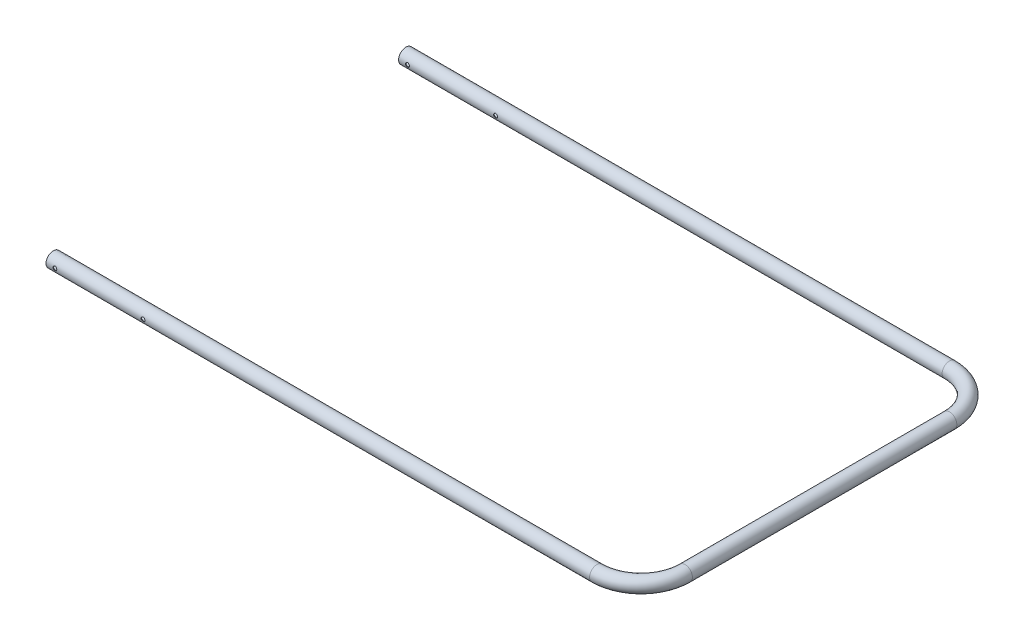
from build123d import *

# Parameters (mm, degrees)
SKETCH2_R               = 12.7
SKETCH2_R_2             = 11.7
CUT_EXTRUDE1_DEPTH      = 1065.529727188
CUT_EXTRUDE1_DEPTH_BACK = 1065.529727188
SKETCH3_R               = 3.3782
CUT_EXTRUDE2_DEPTH      = 1065.529727283
CUT_EXTRUDE2_DEPTH_BACK = 1065.529727283
SKETCH4_R               = 3.3782


with BuildPart() as part:
    # Sweep-Thin1: sweep along a path in Sketch1
    with BuildLine(Plane(origin=(0, 0, 0), x_dir=(1, 0, 0), z_dir=(0, 1, 0))) as sweep_thin1_path:
        Line((-1016, 304.8), (-76.2, 304.8))
        ThreePointArc((-76.2, 304.8), (-22.318463274, 282.481536726), (0, 228.6))
        Line((0, 228.6), (0, -228.6))
        ThreePointArc((0, -228.6), (-22.318463274, -282.481536726), (-76.2, -304.8))
        Line((-76.2, -304.8), (-1016, -304.8))
    # Sketch2 → Sweep-Thin1 (sweep)
    with BuildSketch(Plane(origin=(-1016, 0, 0), x_dir=(0, 0, -1), z_dir=(1, 0, 0))):
        with Locations((304.8, 0)):
            Circle(SKETCH2_R)
        with Locations((304.8, 0)):
            Circle(SKETCH2_R_2, mode=Mode.SUBTRACT)
    sweep(path=sweep_thin1_path.line)

    # Sketch3 → Cut-Extrude1 (cut, two sides: drawn at the far end of the back side and taken through both)
    with BuildSketch(Plane.XY.offset(-CUT_EXTRUDE1_DEPTH_BACK)):
        with Locations((-1000.76, 0)):
            Circle(SKETCH3_R)
    extrude(amount=CUT_EXTRUDE1_DEPTH + CUT_EXTRUDE1_DEPTH_BACK, mode=Mode.SUBTRACT)

    # Sketch4 → Cut-Extrude2 (cut, two sides: drawn at the far end of the back side and taken through both)
    with BuildSketch(Plane.XY.offset(-CUT_EXTRUDE2_DEPTH_BACK)):
        with Locations((-848.36, 0)):
            Circle(SKETCH4_R)
    extrude(amount=CUT_EXTRUDE2_DEPTH + CUT_EXTRUDE2_DEPTH_BACK, mode=Mode.SUBTRACT)


solid = part.part
